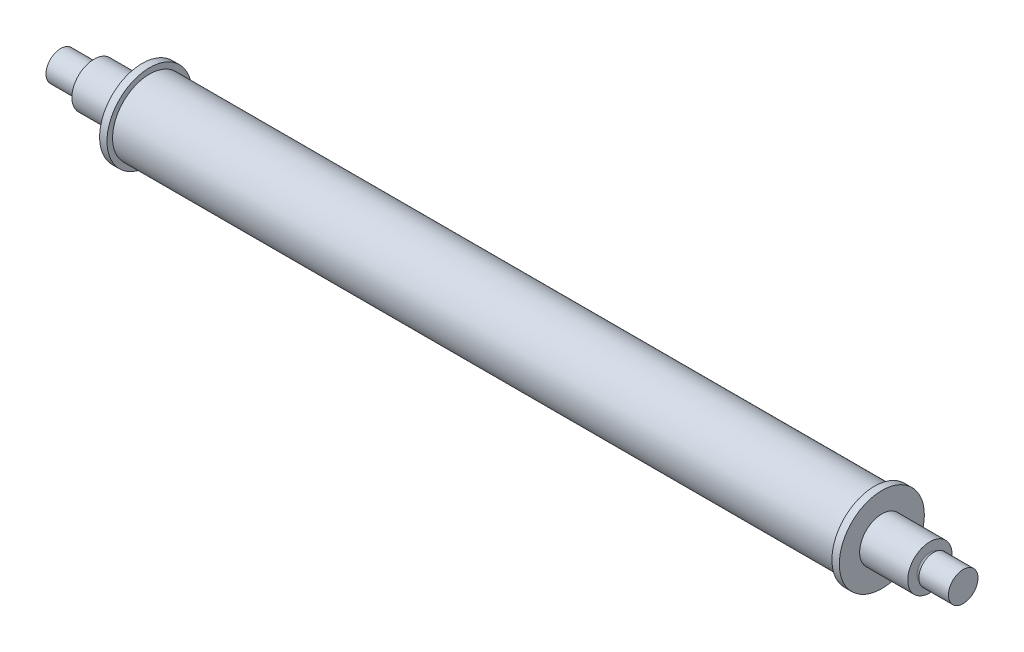
from build123d import *


with BuildPart() as part:
    # Sketch1 → Revolve1 (revolve)
    with BuildSketch(Plane.XY, mode=Mode.PRIVATE) as revolve1_sk:
        with BuildLine():
            Line((-122, 4), (-122, 0))
            Line((-122, 0), (122, 0))
            Line((122, 0), (122, 4))
            Line((122, 4), (114, 4))
            Line((114, 4), (114, 3.5))
            ThreePointArc((114, 3.5), (113.5, 3), (113, 3.5))
            Line((113, 3.5), (113, 6))
            Line((113, 6), (100, 6))
            Line((100, 6), (100, 11.5))
            Line((100, 11.5), (98, 11.5))
            Line((98, 11.5), (98, 10))
            Line((98, 10), (-98, 10))
            Line((-98, 10), (-98, 11.5))
            Line((-98, 11.5), (-100, 11.5))
            Line((-100, 11.5), (-100, 6))
            Line((-100, 6), (-113, 6))
            Line((-113, 6), (-113, 3.5))
            ThreePointArc((-113, 3.5), (-113.5, 3), (-114, 3.5))
            Line((-114, 3.5), (-114, 4))
            Line((-114, 4), (-122, 4))
        make_face()
    revolve(revolve1_sk.sketch.rotate(Axis((-122, 0, 0), (1, 0, 0)), 270), axis=Axis((-122, 0, 0), (1, 0, 0)))


solid = part.part
